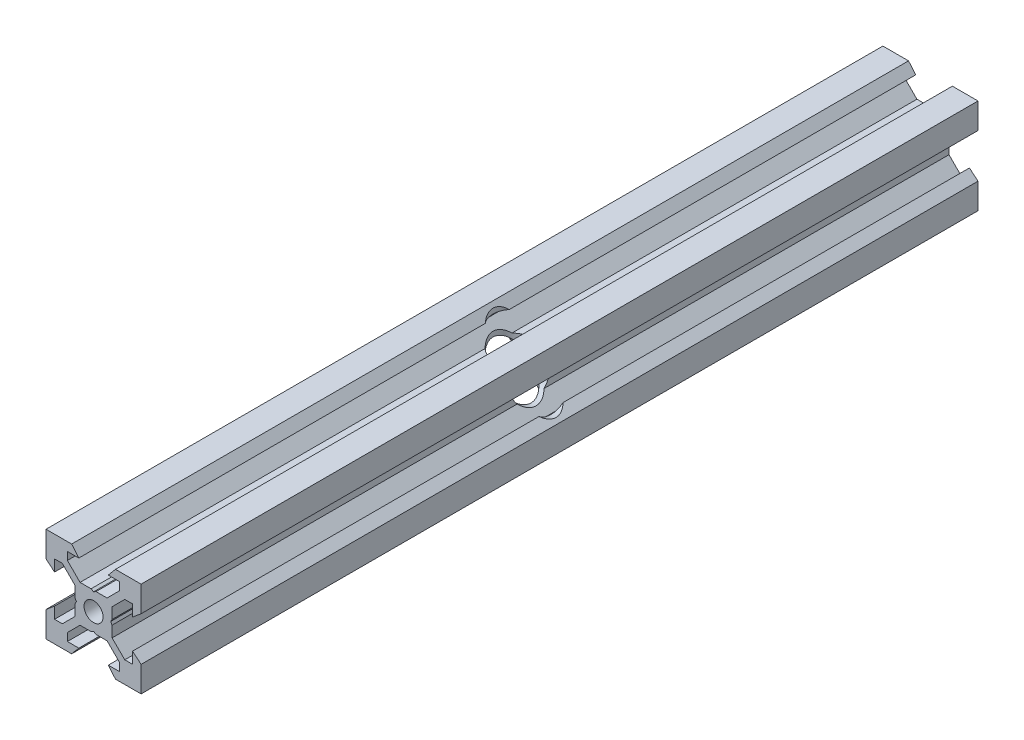
from build123d import *

# Parameters (mm, degrees)
SKETCH1_R               = 2
BOSS_EXTRUDE1_DEPTH     = 176
CUT_EXTRUDE1_DEPTH      = 177.567267635
CUT_EXTRUDE1_DEPTH_BACK = 177.567267635
SKETCH4_R               = 4
CUT_EXTRUDE2_DEPTH      = 177.567267734
CUT_EXTRUDE2_DEPTH_BACK = 177.567267734
SKETCH5_R               = 4


with BuildPart() as part:
    # Sketch1 → Boss-Extrude1 (new body)
    with BuildSketch(Plane.XY):
        Polygon((10, 10), (10, 4.610379336), (8.2, 3.1), (8.2, 5.5), (6.560660172, 5.5), (3.9, 2.839339828), (3.9, 0.519615242), (3.6, 0), (3.9, -0.519615242), (3.9, -2.839339828), (6.560660172, -5.5), (8.2, -5.5), (8.2, -3.1), (10, -4.610379336), (10, -10), (4.610379336, -10), (3.1, -8.2), (5.5, -8.2), (5.5, -6.560660172), (2.839339828, -3.9), (0.519615242, -3.9), (0, -3.6), (-0.519615242, -3.9), (-2.839339828, -3.9), (-5.5, -6.560660172), (-5.5, -8.2), (-3.1, -8.2), (-4.610379336, -10), (-10, -10), (-10, -4.610379336), (-8.2, -3.1), (-8.2, -5.5), (-6.560660172, -5.5), (-3.9, -2.839339828), (-3.9, -0.519615242), (-3.6, 0), (-3.9, 0.519615242), (-3.9, 2.839339828), (-6.560660172, 5.5), (-8.2, 5.5), (-8.2, 3.1), (-10, 4.610379336), (-10, 10), (-4.610379336, 10), (-3.1, 8.2), (-5.5, 8.2), (-5.5, 6.560660172), (-2.839339828, 3.9), (-0.519615242, 3.9), (0, 3.6), (0.519615242, 3.9), (2.839339828, 3.9), (5.5, 6.560660172), (5.5, 8.2), (3.1, 8.2), (4.610379336, 10), align=None)
        Circle(SKETCH1_R, mode=Mode.SUBTRACT)
    extrude(amount=BOSS_EXTRUDE1_DEPTH)

    # Sketch4 → Cut-Extrude1 (cut, two sides: drawn at the far end of the back side and taken through both)
    with BuildSketch(Plane(origin=(0, 0, 0), x_dir=(0, 0, -1), z_dir=(1, 0, 0)).offset(-CUT_EXTRUDE1_DEPTH_BACK)):
        with Locations((-88, 0)):
            Circle(SKETCH4_R)
    extrude(amount=CUT_EXTRUDE1_DEPTH + CUT_EXTRUDE1_DEPTH_BACK, mode=Mode.SUBTRACT)

    # Sketch5 → Cut-Extrude2 (cut, two sides: drawn at the far end of the back side and taken through both)
    with BuildSketch(Plane(origin=(0, 0, 0), x_dir=(1, 0, 0), z_dir=(0, 1, 0)).offset(-CUT_EXTRUDE2_DEPTH_BACK)):
        with Locations(Location((0, -88, 0), (0, 0, 270))):
            Circle(SKETCH5_R)
    extrude(amount=CUT_EXTRUDE2_DEPTH + CUT_EXTRUDE2_DEPTH_BACK, mode=Mode.SUBTRACT)


solid = part.part
